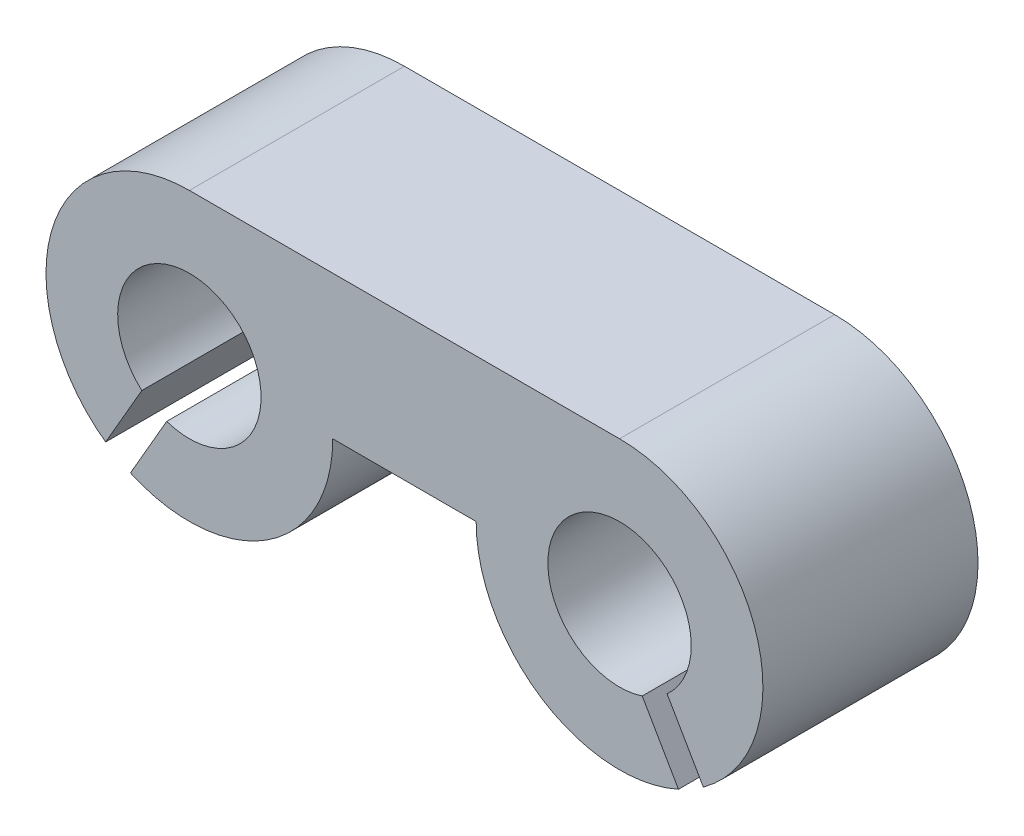
from build123d import *

# Parameters (mm, degrees)
BOSS_EXTRUDE1_DEPTH = 15
SKETCH3_R           = 5
CUT_EXTRUDE1_DEPTH  = 31.822070015
CUT_EXTRUDE2_DEPTH  = 31.822070015


with BuildPart() as part:
    # Sketch2 → Boss-Extrude1 (new body)
    with BuildSketch(Plane.XY):
        with BuildLine():
            Line((-5, 10), (-15, 10))
            ThreePointArc((-15, 10), (-22.071067812, -7.071067812), (-5, 0))
            Line((-5, 0), (5, 0))
            ThreePointArc((5, 0), (22.071067812, -7.071067812), (15, 10))
            Line((15, 10), (5, 10))
            Line((5, 10), (-5, 10))
        make_face()
    extrude(amount=BOSS_EXTRUDE1_DEPTH)

    # Sketch3 → Cut-Extrude1 (cut, through all)
    with BuildSketch(Plane.XY.offset(15)):
        with Locations((-15, 0)):
            Circle(SKETCH3_R)
        with Locations((15, 0)):
            Circle(SKETCH3_R)
    extrude(amount=-CUT_EXTRUDE1_DEPTH, mode=Mode.SUBTRACT)

    # Sketch4 → Cut-Extrude2 (cut, through all)
    with BuildSketch(Plane.XY.offset(15)):
        Polygon((-14.133974596, -0.5), (-15.866025404, 0.5), (-20.866025404, -8.160254038), (-19.133974596, -9.160254038), align=None)
        Polygon((14.133974596, -0.5), (15.866025404, 0.5), (20.866025404, -8.160254038), (19.133974596, -9.160254038), align=None)
    extrude(amount=-CUT_EXTRUDE2_DEPTH, mode=Mode.SUBTRACT)


solid = part.part
